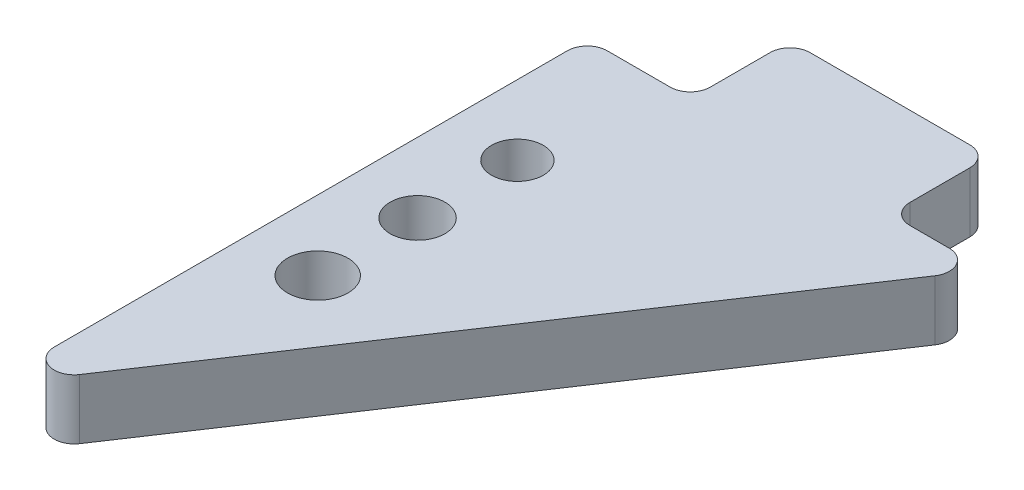
from build123d import *

# Parameters (mm, degrees)
SKETCH1_R           = 1.513481749
SKETCH1_R_2         = 1.371491644
SKETCH1_R_3         = 1.299503913
BOSS_EXTRUDE1_DEPTH = 3


with BuildPart() as part:
    # Sketch1 → Boss-Extrude1 (new body)
    with BuildSketch(Plane(origin=(0, 0, 0), x_dir=(1, 0, 0), z_dir=(0, 1, 0))):
        with BuildLine():
            Line((46.443482118, -40.25819894), (63.574965027, -14.560974577))
            ThreePointArc((63.574965027, -14.560974577), (63.624589331, -13.534416456), (62.742914732, -13.006274381))
            Line((62.742914732, -13.006274381), (60.767784216, -13.006274381))
            ThreePointArc((60.767784216, -13.006274381), (60.060677435, -12.713381162), (59.767784216, -12.006274381))
            Line((59.767784216, -12.006274381), (59.767784216, -9.006274381))
            ThreePointArc((59.767784216, -9.006274381), (59.474890998, -8.2991676), (58.767784216, -8.006274381))
            Line((58.767784216, -8.006274381), (50.767784216, -8.006274381))
            ThreePointArc((50.767784216, -8.006274381), (50.060677435, -8.2991676), (49.767784216, -9.006274381))
            Line((49.767784216, -9.006274381), (49.767784216, -12.006274381))
            ThreePointArc((49.767784216, -12.006274381), (49.474890998, -12.713381162), (48.767784216, -13.006274381))
            Line((48.767784216, -13.006274381), (45.611431824, -13.006274381))
            ThreePointArc((45.611431824, -13.006274381), (44.904325043, -13.2991676), (44.611431824, -14.006274381))
            Line((44.611431824, -14.006274381), (44.611431824, -39.703498743))
            ThreePointArc((44.611431824, -39.703498743), (45.321647675, -40.66059077), (46.443482118, -40.25819894))
        make_face()
        with Locations(Location((48.111431824, -30.006274381, 0), (0, 0, 270))):
            Circle(SKETCH1_R, mode=Mode.SUBTRACT)
        with Locations(Location((48.111431824, -25.006274381, 0), (0, 0, 270))):
            Circle(SKETCH1_R_2, mode=Mode.SUBTRACT)
        with Locations(Location((48.111431824, -20.006274381, 0), (0, 0, 270))):
            Circle(SKETCH1_R_3, mode=Mode.SUBTRACT)
    extrude(amount=BOSS_EXTRUDE1_DEPTH)


solid = part.part
